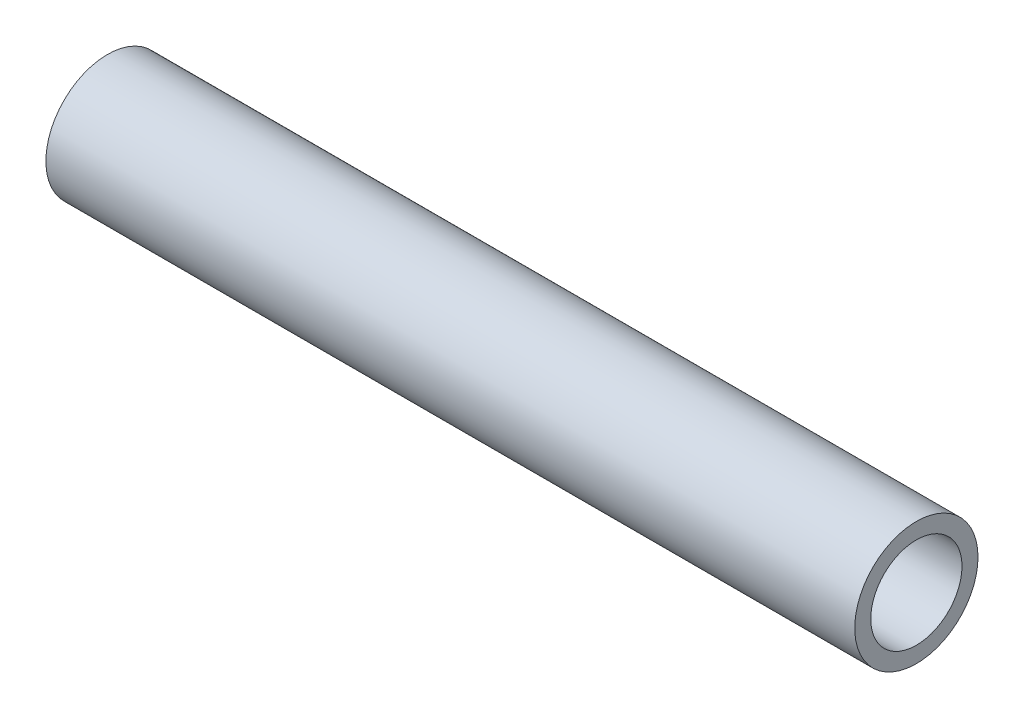
from build123d import *

# Parameters (mm, degrees)
SKETCH11_R              = 10.668
SKETCH11_R_2            = 7.8994
PIPE_0_5_SCH_40_1_DEPTH = 140


with BuildPart() as part:
    # Sketch11 → Pipe 0.5 SCH 40(1) (new body)
    with BuildSketch(Plane(origin=(-70, 0, 0), x_dir=(0, 0, -1), z_dir=(1, 0, 0))):
        Circle(SKETCH11_R)
        Circle(SKETCH11_R_2, mode=Mode.SUBTRACT)
    extrude(amount=PIPE_0_5_SCH_40_1_DEPTH)


solid = part.part
